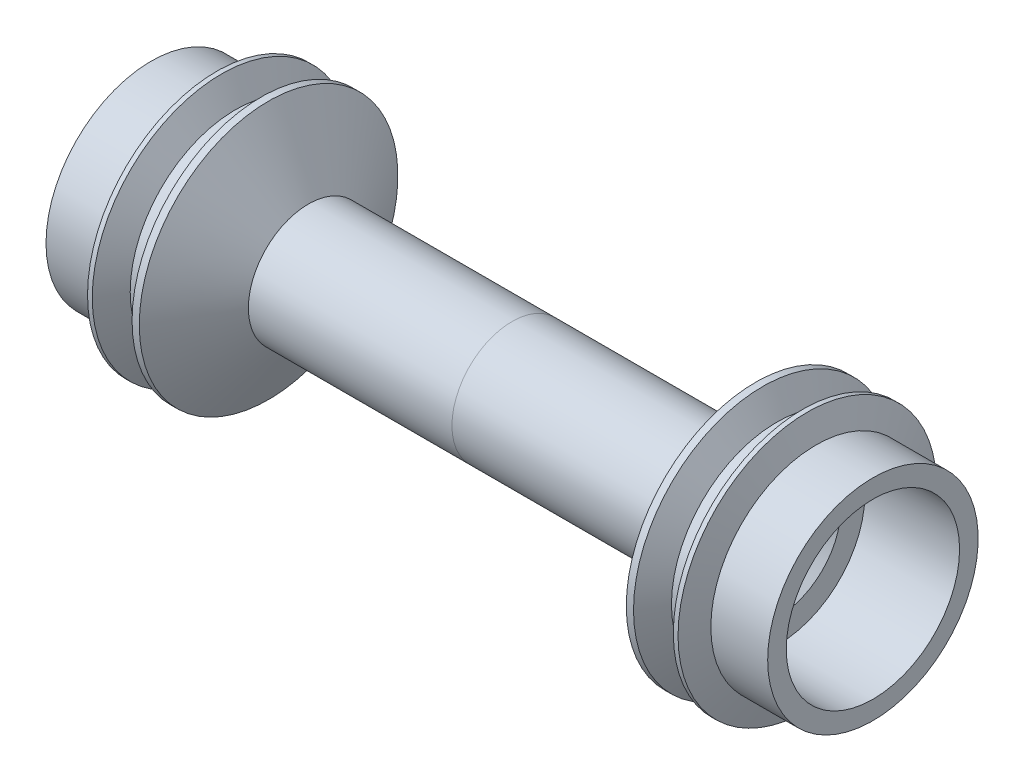
from build123d import *

# Parameters (mm, degrees)
CHAMFER1_SIZE = 0.508


with BuildPart() as part:
    # Sketch2 → Revolve1 (revolve)
    with BuildSketch(Plane.XY, mode=Mode.PRIVATE) as revolve1_sk:
        Polygon((-16.05, 5.55625), (-19.05, 5.55625), (-19.05, 4.575), (-14.05, 4.575), (-14.05, 3.305), (-13.542, 2.797), (-13.542, 1.7145), (-9.225, 1.7145), (-9.225, 0), (-8.1, 0), (-6.5, 1.6), (0, 1.6), (0, 3.175), (-10.747714988, 3.175), (-12.855765158, 6.82625), (-13.236765158, 6.82625), (-13.97, 5.55625), (-14.605, 5.55625), (-15.338234842, 6.82625), (-15.587757802, 6.82625), align=None)
    revolve(revolve1_sk.sketch.rotate(Axis((-19.05, 0, 0), (1, 0, 0)), 90), axis=Axis((-19.05, 0, 0), (1, 0, 0)))


with BuildPart() as body_2:
    # Mirror1: mirrored copy
    add(part.part.mirror(Plane(origin=(0, 0, 0), x_dir=(0, 0, 1), z_dir=(1, 0, 0))))


with BuildPart() as part_1:
    add(part.part)

    # Chamfer1
    chamfer1_edges = [part_1.edges().sort_by_distance(p)[0] for p in [
        (-19.05, 0, -4.575),
    ]]
    chamfer(chamfer1_edges, length=CHAMFER1_SIZE)


solid = Compound([body_2.part, part_1.part])
